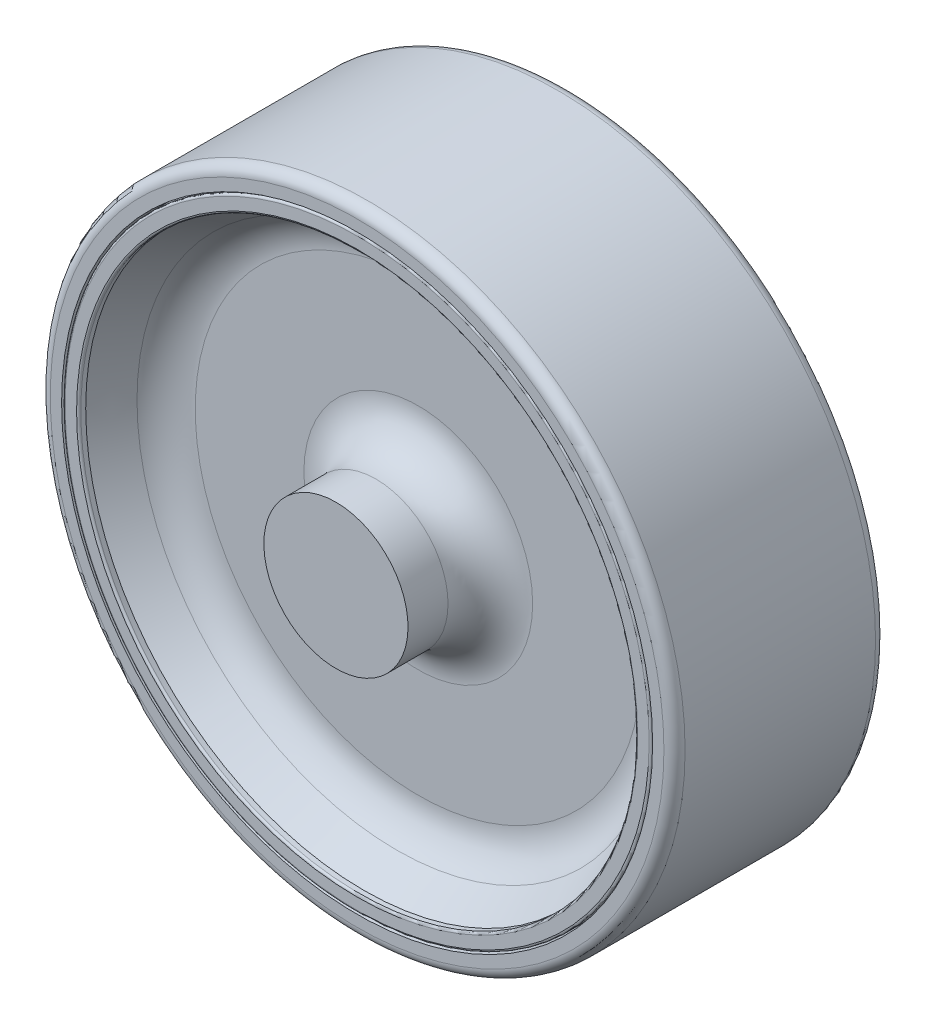
from build123d import *

# Parameters (mm, degrees)
SKETCH1_R           = 150
BOSS_EXTRUDE1_DEPTH = 100
FILLET1_R           = 20
FILLET2_R           = 20
SKETCH4_W           = 10
SKETCH4_H           = 34.059283547
FILLET3_R           = 5
SKETCH6_R           = 139.644957961
SKETCH6_R_2         = 139.005574042
CUT_EXTRUDE2_DEPTH  = 123
FILLET4_R           = 1
FILLET5_R           = 1
FILLET6_R           = 1


with BuildPart() as part:
    # Sketch1 → Boss-Extrude1 (new body)
    with BuildSketch(Plane.XY):
        Circle(SKETCH1_R)
    extrude(amount=BOSS_EXTRUDE1_DEPTH)

    # Sketch2 → Cut-Revolve1 (revolve, cut)
    with BuildSketch(Plane(origin=(0, 0, 0), x_dir=(0, 0, -1), z_dir=(1, 0, 0)), mode=Mode.PRIVATE) as cut_revolve1_sk:
        Polygon((0, 131.569110556), (-6.085999893, 131.569110556), (-55.186692926, 117.046370363), (-55.186692926, 34.059283547), (0, 27.143692979), align=None)
        Polygon((-100, 131.569110556), (-96.680236334, 131.569110556), (-71.092551232, 117.046370363), (-71.092551232, 34.059283547), (-100, 34.059283547), align=None)
    revolve(cut_revolve1_sk.sketch.rotate(Axis((0, 0, 0), (0, 0, 1)), 90), axis=Axis((0, 0, 0), (0, 0, 1)), mode=Mode.SUBTRACT)

    # Fillet1
    fillet1_edges = [part.edges().sort_by_distance(p)[0] for p in [
        (34.059283547, 0, 55.186692926),
        (117.046370363, 0, 55.186692926),
    ]]
    fillet(fillet1_edges, radius=FILLET1_R)

    # Fillet2
    fillet2_edges = [part.edges().sort_by_distance(p)[0] for p in [
        (117.046370363, 0, 71.092551232),
        (34.059283547, 0, 71.092551232),
    ]]
    fillet(fillet2_edges, radius=FILLET2_R)

    # Sketch4 → Revolve1 (revolve)
    with BuildSketch(Plane(origin=(0, 0, 0), x_dir=(0, 0, -1), z_dir=(1, 0, 0)), mode=Mode.PRIVATE) as revolve1_sk:
        Polygon((0, 0), (5, 0), (5, 26.517129744), (0, 27.143692979), align=None)
        with Locations((-105, 17.029641773)):
            Rectangle(SKETCH4_W, SKETCH4_H)
    revolve(revolve1_sk.sketch.rotate(Axis((0, 0, 100), (0, 0, 1)), 270), axis=Axis((0, 0, 100), (0, 0, 1)))

    # Fillet3
    fillet3_edges = [part.edges().sort_by_distance(p)[0] for p in [
        (-150, 0, 0),
        (-150, 0, 100),
    ]]
    fillet(fillet3_edges, radius=FILLET3_R)

    # Sketch6 → Cut-Extrude2 (cut)
    with BuildSketch(Plane(origin=(0, 0, -5), x_dir=(-1, 0, 0), z_dir=(0, 0, -1))):
        with Locations(Location((0, 0, 0), (0, 0, 180))):
            Circle(SKETCH6_R)
        with Locations(Location((0, 0, 0), (0, 0, 180))):
            Circle(SKETCH6_R_2, mode=Mode.SUBTRACT)
    extrude(amount=-CUT_EXTRUDE2_DEPTH, mode=Mode.SUBTRACT)


with BuildPart() as cut_extrude2_piece_1:
    # of the separate pieces the step leaves, piece 1, a body of its own (cut_extrude2_pieces)
    add(part.part.solids().sort_by_distance((139.005574042, 0, 100))[0])

    # Fillet5
    fillet5_edges = [cut_extrude2_piece_1.edges().sort_by_distance(p)[0] for p in [
        (131.569110556, 0, 100),
        (-139.005574042, 0, 100),
    ]]
    fillet(fillet5_edges, radius=FILLET5_R)

    # Fillet6
    fillet6_edges = [cut_extrude2_piece_1.edges().sort_by_distance(p)[0] for p in [
        (131.569110556, 0, 0),
        (-139.005574042, 0, 0),
    ]]
    fillet(fillet6_edges, radius=FILLET6_R)


with BuildPart() as cut_extrude2_piece_2:
    # of the separate pieces the step leaves, piece 2, a body of its own (cut_extrude2_pieces)
    add(part.part.solids().sort_by_distance((145, 0, 100))[0])

    # Fillet4
    fillet4_edges = [cut_extrude2_piece_2.edges().sort_by_distance(p)[0] for p in [
        (-139.644957961, 0, 0),
    ]]
    fillet(fillet4_edges, radius=FILLET4_R)


solid = Compound([cut_extrude2_piece_1.part, cut_extrude2_piece_2.part])
